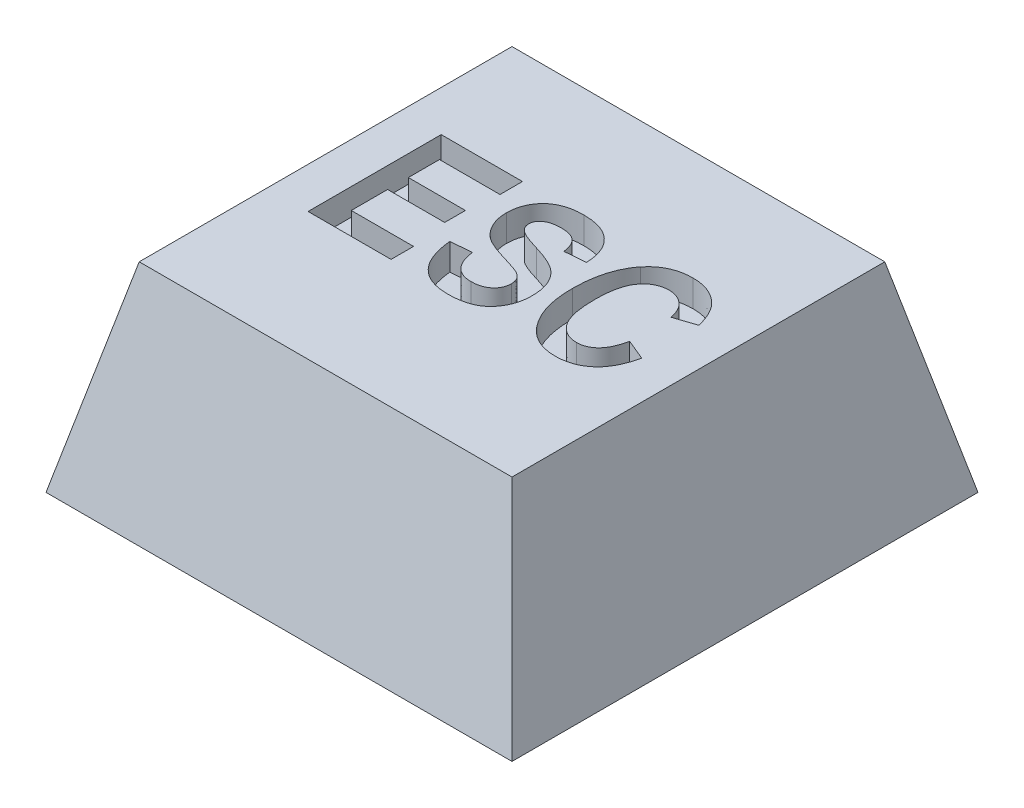
from build123d import *

# Parameters (mm, degrees)
SKETCH1_W           = 7
SKETCH1_H           = 7
BOSS_EXTRUDE1_DEPTH = 3
CUT_EXTRUDE1_DEPTH  = 7
CUT_EXTRUDE2_DEPTH  = 11
SKETCH4_R           = 1.8
CUT_EXTRUDE3_DEPTH  = 0.8
CUT_EXTRUDE4_DEPTH  = 0.4


with BuildPart() as part:
    # Sketch1 → Boss-Extrude1 (new body)
    with BuildSketch(Plane(origin=(0, 0, 0), x_dir=(1, 0, 0), z_dir=(0, 1, 0))):
        with Locations((3.5, 3.5)):
            Rectangle(SKETCH1_W, SKETCH1_H)
    extrude(amount=BOSS_EXTRUDE1_DEPTH)

    # Sketch2 → Cut-Extrude1 (cut)
    with BuildSketch(Plane.XY):
        Polygon((0, 0), (0.7, 3), (0, 3), align=None)
        Polygon((7, 0), (6.3, 3), (7, 3), align=None)
    extrude(amount=-CUT_EXTRUDE1_DEPTH, mode=Mode.SUBTRACT)

    # Sketch3 → Cut-Extrude2 (cut)
    with BuildSketch(Plane(origin=(0, 0, 0), x_dir=(0, 0, -1), z_dir=(1, 0, 0))):
        Polygon((0, 0), (0.7, 3), (0, 3), align=None)
        Polygon((7, 3), (6.3, 3), (7, 0), align=None)
    extrude(amount=CUT_EXTRUDE2_DEPTH, mode=Mode.SUBTRACT)

    # Sketch4 → Cut-Extrude3 (cut)
    with BuildSketch(Plane.XZ):
        with Locations(Location((3.5, -3.5, 0), (0, 0, 270))):
            Circle(SKETCH4_R)
    extrude(amount=-CUT_EXTRUDE3_DEPTH, mode=Mode.SUBTRACT)

    # Sketch5 → Cut-Extrude4 (cut)
    with BuildSketch(Plane(origin=(0, 3, 0), x_dir=(1, 0, 0), z_dir=(0, 1, 0))):
        Polygon((1.313632544, 2.622894208), (1.313632544, 4.622894208), (2.534411765, 4.622894208), (2.534411765, 4.28523187), (1.625320856, 4.28523187), (1.625320856, 3.817699403), (2.482463713, 3.817699403), (2.482463713, 3.506011091), (1.625320856, 3.506011091), (1.625320856, 2.960556546), (2.560385791, 2.960556546), (2.560385791, 2.622894208), align=None)
        with BuildLine():
            Line((2.768177998, 3.298218883), (3.07986631, 3.324192909))
            add(Edge.make_bspline(
                [(3.07986631, 3.324192909), (3.082380467, 3.308463112), (3.087283166, 3.277789434), (3.097614462, 3.233691709), (3.109094428, 3.1923045), (3.123466316, 3.154338494), (3.139124242, 3.118960997), (3.157481877, 3.08707087), (3.17739243, 3.057757347), (3.199723566, 3.03190082), (3.223897523, 3.008897552), (3.249899224, 2.988825395), (3.278220169, 2.972191792), (3.308323812, 2.958205875), (3.340676335, 2.947795831), (3.374871875, 2.939976709), (3.411191696, 2.935577365), (3.4360509, 2.934919396), (3.448778648, 2.93458252)],
                knots=[0, 0, 0, 0, 1.283284002, 2.502450598, 3.648036641, 4.741550817, 5.771019705, 6.762197452, 7.702675527, 8.622646947, 9.509464764, 10.388204522, 11.263216913, 12.15103932, 13.057737472, 13.996634539, 14.974290105, 16, 16, 16, 16], degree=3))
            add(Edge.make_bspline(
                [(3.448778648, 2.93458252), (3.461369449, 2.934803289), (3.485930046, 2.935233938), (3.5216101, 2.938945388), (3.555337287, 2.94490843), (3.586775857, 2.953894107), (3.616388824, 2.964950633), (3.644130894, 2.978078674), (3.669247819, 2.994652221), (3.692562924, 3.012756647), (3.71305227, 3.033189434), (3.731571701, 3.054463053), (3.746564132, 3.077599124), (3.759331524, 3.101535094), (3.76906326, 3.12677034), (3.775924646, 3.153189907), (3.780690692, 3.180622387), (3.781006012, 3.199442952), (3.781165011, 3.208933169)],
                knots=[0, 0, 0, 0, 1.24984806, 2.438050946, 3.557771333, 4.64636299, 5.679248938, 6.694516573, 7.68559378, 8.661074055, 9.620421872, 10.554324834, 11.455887309, 12.351123657, 13.244140324, 14.133614264, 15.058880124, 16, 16, 16, 16], degree=3))
            add(Edge.make_bspline(
                [(3.781165011, 3.208933169), (3.780793918, 3.219919013), (3.78007308, 3.241258675), (3.773942505, 3.272113921), (3.763381075, 3.300364456), (3.748366395, 3.326001394), (3.729559865, 3.349328718), (3.70630068, 3.37041081), (3.678495387, 3.388860786), (3.651734015, 3.402755883), (3.626250613, 3.413973383), (3.601249657, 3.422976796), (3.571408673, 3.434206436), (3.535886448, 3.445641597), (3.495508741, 3.459106605), (3.44988225, 3.47391372), (3.398698732, 3.489016813), (3.362867016, 3.499897559), (3.344070856, 3.505605247)],
                knots=[0, 0, 0, 0, 0.920834509, 1.788692479, 2.625355144, 3.438845263, 4.269949672, 5.129384894, 6.060923099, 7.060788299, 7.655274663, 8.394990962, 9.288793567, 10.329357386, 11.524217089, 12.85908646, 14.352378214, 16, 16, 16, 16], degree=3))
            add(Edge.make_bspline(
                [(3.344070856, 3.505605247), (3.326984739, 3.510757023), (3.293881087, 3.520738377), (3.24640271, 3.537288868), (3.202097821, 3.552984808), (3.161902976, 3.570462889), (3.124676586, 3.587224199), (3.091293383, 3.60500568), (3.061305155, 3.622955129), (3.026061923, 3.64721888), (2.986800634, 3.681301073), (2.945084697, 3.727595811), (2.908421155, 3.779557056), (2.876887734, 3.836658961), (2.851313539, 3.897817642), (2.833623438, 3.96222051), (2.822146132, 4.028598594), (2.820803464, 4.073739491), (2.82012605, 4.096514338)],
                knots=[0, 0, 0, 0, 0.995705067, 1.929137906, 2.805643294, 3.617475646, 4.374079425, 5.083250302, 5.726695175, 6.323501674, 7.469021963, 8.618192986, 9.793256335, 11.00968795, 12.251802723, 13.482671819, 14.729937436, 16, 16, 16, 16], degree=3))
            add(Edge.make_bspline(
                [(2.82012605, 4.096514338), (2.821045884, 4.122827636), (2.822852086, 4.174496907), (2.837599946, 4.249945698), (2.861004606, 4.321435308), (2.894084452, 4.388156659), (2.935184769, 4.449042246), (2.984369376, 4.502343544), (3.040769189, 4.547535654), (3.104405788, 4.584849458), (3.175818017, 4.613661001), (3.254799312, 4.634079265), (3.341354344, 4.646892691), (3.401653281, 4.648193213), (3.432950726, 4.648868234)],
                knots=[0, 0, 0, 0, 1.016001525, 1.995039112, 2.958718515, 3.914826359, 4.86299968, 5.787773554, 6.706158304, 7.645676028, 8.628001228, 9.67146541, 10.791401858, 12, 12, 12, 12], degree=3))
            add(Edge.make_bspline(
                [(3.432950726, 4.648868234), (3.456778505, 4.648417492), (3.503333349, 4.64753683), (3.571077174, 4.640207489), (3.634701938, 4.627986842), (3.694481195, 4.611507482), (3.750173962, 4.589683706), (3.801613071, 4.5624806), (3.849622168, 4.531498533), (3.892486327, 4.494467501), (3.931848356, 4.453960376), (3.966055221, 4.408706393), (3.994883384, 4.359061561), (4.019379714, 4.305702894), (4.038897645, 4.248030075), (4.053312491, 4.186179119), (4.063211636, 4.120204767), (4.065635951, 4.074768368), (4.066879297, 4.051465637)],
                knots=[0, 0, 0, 0, 1.161082811, 2.268529788, 3.315920136, 4.315767948, 5.286675817, 6.224491986, 7.147968113, 8.064782936, 8.978748437, 9.896534752, 10.821515985, 11.771513441, 12.753550833, 13.783446476, 14.863207619, 16, 16, 16, 16], degree=3))
            Line((4.066879297, 4.051465637), (3.755190985, 4.025491611))
            add(Edge.make_bspline(
                [(3.755190985, 4.025491611), (3.752997812, 4.038226946), (3.748755088, 4.062863622), (3.740848252, 4.098366323), (3.730675267, 4.13075234), (3.719015345, 4.160350992), (3.705156696, 4.186573289), (3.690154887, 4.210221523), (3.672975617, 4.230558217), (3.647869769, 4.254174891), (3.610213935, 4.277702698), (3.557840354, 4.297489323), (3.497303562, 4.309100764), (3.454378017, 4.310478886), (3.431733193, 4.311205896)],
                knots=[0, 0, 0, 0, 0.959243267, 1.855668837, 2.69732651, 3.476781153, 4.213401683, 4.895802106, 5.551525866, 6.183841498, 7.448472762, 8.815414589, 10.320012641, 12, 12, 12, 12], degree=3))
            add(Edge.make_bspline(
                [(3.431733193, 4.311205896), (3.409096405, 4.31069601), (3.366270869, 4.309731379), (3.306018757, 4.299614099), (3.253624969, 4.283040397), (3.210179653, 4.258899705), (3.175547482, 4.230147078), (3.150126214, 4.197357597), (3.13450472, 4.160438217), (3.132716332, 4.1344021), (3.131814362, 4.121270832)],
                knots=[0, 0, 0, 0, 1.375503163, 2.602253489, 3.70275074, 4.700811603, 5.605681669, 6.421826054, 7.204050882, 8, 8, 8, 8], degree=3))
            add(Edge.make_bspline(
                [(3.131814362, 4.121270832), (3.132689045, 4.108441817), (3.134408607, 4.083220922), (3.147756154, 4.047077038), (3.169739591, 4.01420354), (3.189928585, 3.99651733), (3.200402024, 3.98734226)],
                knots=[0, 0, 0, 0, 0.986511101, 1.93940795, 2.931027269, 4, 4, 4, 4], degree=3))
            add(Edge.make_bspline(
                [(3.200402024, 3.98734226), (3.206798172, 3.982590969), (3.220936114, 3.972088793), (3.246405497, 3.958542774), (3.276306299, 3.943187597), (3.31196996, 3.928588495), (3.352265674, 3.912596757), (3.39818059, 3.896959911), (3.449004874, 3.880306254), (3.484872554, 3.86956449), (3.503567609, 3.863965637)],
                knots=[0, 0, 0, 0, 0.580970997, 1.284168869, 2.101321398, 3.035084219, 4.095219995, 5.266568887, 6.575273271, 8, 8, 8, 8], degree=3))
            add(Edge.make_bspline(
                [(3.503567609, 3.863965637), (3.523636998, 3.857889272), (3.562461933, 3.846134333), (3.618000535, 3.826696531), (3.669653529, 3.808386305), (3.716796557, 3.789342133), (3.759485135, 3.769770005), (3.798110918, 3.75034929), (3.832625889, 3.731029098), (3.872641632, 3.705256118), (3.916562345, 3.669406243), (3.963538628, 3.621609573), (4.002428398, 3.566678956), (4.035863915, 3.506806133), (4.061287805, 3.440180287), (4.080017581, 3.367538257), (4.090931489, 3.288131716), (4.092196836, 3.233047625), (4.092853323, 3.204468883)],
                knots=[0, 0, 0, 0, 1.035756796, 2.003707701, 2.906407247, 3.742850513, 4.51441117, 5.225734541, 5.878106001, 6.467575161, 7.574958109, 8.671458568, 9.767653495, 10.889322485, 12.050953544, 13.27960766, 14.588605383, 16, 16, 16, 16], degree=3))
            add(Edge.make_bspline(
                [(4.092853323, 3.204468883), (4.09245307, 3.18347154), (4.091665231, 3.142141438), (4.083429654, 3.081526419), (4.071687412, 3.02325294), (4.053955374, 2.967553592), (4.031301329, 2.91460108), (4.003799329, 2.863991456), (3.971273342, 2.816182567), (3.934038058, 2.770946475), (3.891372882, 2.729619462), (3.842744205, 2.693842748), (3.788554719, 2.663427596), (3.728533809, 2.639387131), (3.663153335, 2.620281389), (3.592247311, 2.606588549), (3.515659036, 2.598527847), (3.462732559, 2.597467867), (3.435385791, 2.596920182)],
                knots=[0, 0, 0, 0, 0.991804927, 1.952218352, 2.886457782, 3.798464992, 4.709395717, 5.604960052, 6.516496456, 7.438312874, 8.369857157, 9.316183769, 10.2837644, 11.298954172, 12.365211701, 13.498800204, 14.707646267, 16, 16, 16, 16], degree=3))
            add(Edge.make_bspline(
                [(3.435385791, 2.596920182), (3.411013544, 2.597473019), (3.36361619, 2.598548136), (3.294578702, 2.606669561), (3.229816513, 2.620527751), (3.168983347, 2.639326798), (3.112565649, 2.664511053), (3.059863812, 2.694354635), (3.011758506, 2.73037619), (2.96789904, 2.771875805), (2.928128253, 2.818740012), (2.892108746, 2.870954012), (2.861086226, 2.928996486), (2.833632631, 2.992159791), (2.81135103, 3.061085491), (2.792045999, 3.13512579), (2.777579279, 3.214791054), (2.771368991, 3.269901721), (2.768177998, 3.298218883)],
                knots=[0, 0, 0, 0, 1.077126704, 2.094716892, 3.06695406, 4.001175917, 4.903369973, 5.792630967, 6.672819179, 7.55264172, 8.45610307, 9.384912885, 10.350803934, 11.360510561, 12.42508299, 13.549057315, 14.740647766, 16, 16, 16, 16], degree=3))
        make_face()
        with BuildLine():
            Line((5.417528648, 3.350166935), (5.729216959, 3.220296806))
            add(Edge.make_bspline(
                [(5.729216959, 3.220296806), (5.722779707, 3.194096531), (5.710236403, 3.143044003), (5.6865062, 3.070075592), (5.660393822, 3.00237202), (5.630519797, 2.940312249), (5.597908349, 2.883351807), (5.561683666, 2.832051207), (5.522527281, 2.786147786), (5.480216482, 2.745748801), (5.434819889, 2.710988703), (5.387612119, 2.680013927), (5.337374131, 2.654621208), (5.284809391, 2.633180965), (5.229504645, 2.617243707), (5.171880085, 2.60525026), (5.111688372, 2.598387051), (5.070683979, 2.597414639), (5.049833843, 2.596920182)],
                knots=[0, 0, 0, 0, 1.282586353, 2.499182829, 3.646034602, 4.730797578, 5.771318175, 6.763713287, 7.712684321, 8.6363956, 9.539720391, 10.428356747, 11.317388874, 12.212151588, 13.124116906, 14.050177375, 15.008543639, 16, 16, 16, 16], degree=3))
            add(Edge.make_bspline(
                [(5.049833843, 2.596920182), (5.023673269, 2.597508336), (4.972425324, 2.598660516), (4.897644723, 2.611057685), (4.82648454, 2.629893023), (4.759073045, 2.656940687), (4.695330301, 2.691513361), (4.635929696, 2.734336695), (4.579485169, 2.78381645), (4.546666563, 2.822396077), (4.529947479, 2.842050052)],
                knots=[0, 0, 0, 0, 1.053414494, 2.063614103, 3.046293227, 4.01520277, 4.983805463, 5.961130836, 6.961320097, 8, 8, 8, 8], degree=3))
            add(Edge.make_bspline(
                [(4.529947479, 2.842050052), (4.511569846, 2.866315351), (4.474546405, 2.915200039), (4.42806553, 2.995810802), (4.388532654, 3.08241352), (4.356176944, 3.175086685), (4.330957374, 3.273932968), (4.31332562, 3.378999496), (4.302737214, 3.490235445), (4.301353329, 3.566458201), (4.300645531, 3.605442909)],
                knots=[0, 0, 0, 0, 0.898140554, 1.809387162, 2.740718204, 3.705966939, 4.703925369, 5.74945803, 6.848943185, 8, 8, 8, 8], degree=3))
            add(Edge.make_bspline(
                [(4.300645531, 3.605442909), (4.301292156, 3.64659678), (4.302551673, 3.726757616), (4.31389172, 3.843464172), (4.331179134, 3.953490677), (4.356953952, 4.056428183), (4.389242588, 4.152867763), (4.429135105, 4.242208033), (4.475454321, 4.325383356), (4.513245506, 4.375058465), (4.5319767, 4.399679922)],
                knots=[0, 0, 0, 0, 1.171098873, 2.281104103, 3.334483992, 4.338438261, 5.297974877, 6.225356982, 7.120398547, 8, 8, 8, 8], degree=3))
            add(Edge.make_bspline(
                [(4.5319767, 4.399679922), (4.548983698, 4.419582488), (4.582500843, 4.458806177), (4.639789617, 4.509598098), (4.701335748, 4.55277304), (4.767116964, 4.588122349), (4.837427613, 4.615615889), (4.911923576, 4.635015759), (4.990903123, 4.646462459), (5.044925747, 4.648054052), (5.072561115, 4.648868234)],
                knots=[0, 0, 0, 0, 1.017460211, 2.005195831, 2.96880208, 3.936538458, 4.903086366, 5.898753713, 6.925103759, 8, 8, 8, 8], degree=3))
            add(Edge.make_bspline(
                [(5.072561115, 4.648868234), (5.095176928, 4.648326895), (5.139627248, 4.647262918), (5.204805581, 4.638757005), (5.266903968, 4.623800545), (5.32652858, 4.604182338), (5.3831563, 4.577933379), (5.436950871, 4.546081798), (5.488123841, 4.508732315), (5.519140588, 4.479696577), (5.534817609, 4.465020832)],
                knots=[0, 0, 0, 0, 1.062174293, 2.087653736, 3.080296642, 4.058948008, 5.03139012, 6.005719887, 6.992016441, 8, 8, 8, 8], degree=3))
            add(Edge.make_bspline(
                [(5.534817609, 4.465020832), (5.545717689, 4.45370997), (5.567928988, 4.430661616), (5.597836551, 4.391838103), (5.625525765, 4.349081527), (5.650500193, 4.302209423), (5.673718125, 4.251679914), (5.694830587, 4.197233988), (5.713403671, 4.138747783), (5.723864432, 4.098191413), (5.729216959, 4.077439663)],
                knots=[0, 0, 0, 0, 0.858002413, 1.748367619, 2.673305357, 3.63929672, 4.648357542, 5.711115493, 6.828831091, 8, 8, 8, 8], degree=3))
            Line((5.729216959, 4.077439663), (5.417528648, 3.973543559))
            add(Edge.make_bspline(
                [(5.417528648, 3.973543559), (5.414599729, 3.986846012), (5.408900541, 4.012730376), (5.39745802, 4.050085035), (5.383527208, 4.08478009), (5.368370301, 4.117648445), (5.350118864, 4.147553234), (5.331027285, 4.175923327), (5.308640621, 4.201058129), (5.28498973, 4.224278375), (5.259240379, 4.244344518), (5.232883604, 4.262491212), (5.205133607, 4.277578859), (5.176106143, 4.28971312), (5.146145015, 4.299533405), (5.115026969, 4.30643927), (5.082823217, 4.310621228), (5.060939682, 4.311009068), (5.049833843, 4.311205896)],
                knots=[0, 0, 0, 0, 1.200071046, 2.335138942, 3.437621639, 4.493482591, 5.51985659, 6.521917265, 7.50210956, 8.480124453, 9.438987346, 10.374745328, 11.297656865, 12.216555725, 13.143999084, 14.072438006, 15.021767148, 16, 16, 16, 16], degree=3))
            add(Edge.make_bspline(
                [(5.049833843, 4.311205896), (5.034116324, 4.31073989), (5.003182639, 4.309822741), (4.957862128, 4.302525716), (4.914982768, 4.289619315), (4.873898993, 4.272675754), (4.835301168, 4.250101884), (4.798759605, 4.222764609), (4.76525687, 4.189837779), (4.733148033, 4.152800745), (4.704051993, 4.109888687), (4.679347469, 4.060293759), (4.65897072, 4.004193015), (4.641418555, 3.941988806), (4.628286307, 3.873272442), (4.619172931, 3.798150337), (4.613485157, 3.71673143), (4.61272644, 3.660241638), (4.612333843, 3.631011091)],
                knots=[0, 0, 0, 0, 0.827686898, 1.628972485, 2.409099021, 3.181967192, 3.964173723, 4.757978677, 5.579415306, 6.433460257, 7.33665582, 8.302235029, 9.343905073, 10.476376866, 11.703364719, 13.024698166, 14.460435141, 16, 16, 16, 16], degree=3))
            add(Edge.make_bspline(
                [(4.612333843, 3.631011091), (4.612777457, 3.600702465), (4.613631725, 3.542337231), (4.618611418, 3.458038269), (4.628076634, 3.380586831), (4.640192829, 3.309678373), (4.656772707, 3.245727361), (4.677028229, 3.188694626), (4.700359369, 3.138023379), (4.728190917, 3.094378434), (4.759028823, 3.056699852), (4.791815157, 3.023986635), (4.827182895, 2.996659293), (4.864185858, 2.973499528), (4.903839926, 2.955949672), (4.945675976, 2.944009144), (4.989445892, 2.935750459), (5.019491203, 2.934977046), (5.034817609, 2.93458252)],
                knots=[0, 0, 0, 0, 1.588381619, 3.058741945, 4.422565575, 5.675514383, 6.825848758, 7.879737597, 8.8437938, 9.742560847, 10.584031071, 11.391113559, 12.163968987, 12.921455088, 13.673648094, 14.427376256, 15.197789283, 16, 16, 16, 16], degree=3))
            add(Edge.make_bspline(
                [(5.034817609, 2.93458252), (5.046058234, 2.934930649), (5.068356485, 2.935621239), (5.101168556, 2.940018716), (5.132831653, 2.947881322), (5.163350048, 2.958789797), (5.192593672, 2.973182136), (5.220862565, 2.990232878), (5.24758566, 3.010728056), (5.273456357, 3.033999322), (5.297857092, 3.060765392), (5.3201575, 3.091538833), (5.340877099, 3.125769645), (5.359890629, 3.163670123), (5.377319355, 3.204996674), (5.392686367, 3.250066428), (5.406592086, 3.298654376), (5.413812909, 3.332665348), (5.417528648, 3.350166935)],
                knots=[0, 0, 0, 0, 0.874040642, 1.73385169, 2.568061146, 3.406503852, 4.248567505, 5.09821747, 5.96915136, 6.862782357, 7.800986125, 8.779254107, 9.812897901, 10.908933612, 12.073249979, 13.297367906, 14.609261928, 16, 16, 16, 16], degree=3))
        make_face()
    extrude(amount=-CUT_EXTRUDE4_DEPTH, mode=Mode.SUBTRACT)


solid = part.part
